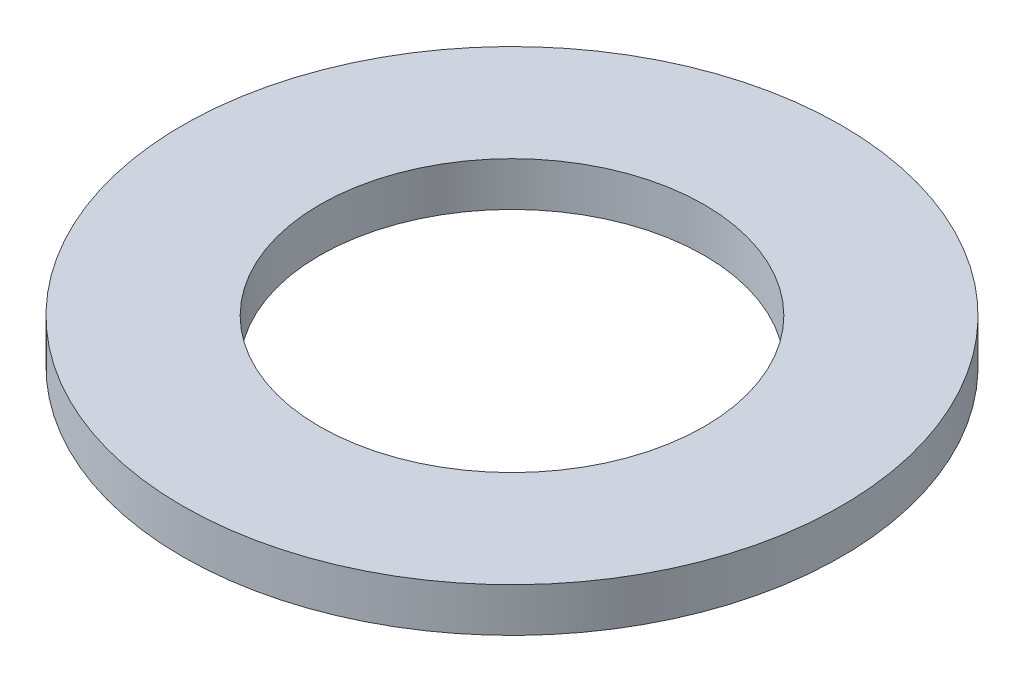
from build123d import *

# Parameters (mm, degrees)
SKETCH1_R           = 3
SKETCH1_R_2         = 1.75
BOSS_EXTRUDE1_DEPTH = 0.4


with BuildPart() as part:
    # Sketch1 → Boss-Extrude1 (new body)
    with BuildSketch(Plane(origin=(0, 0, 0), x_dir=(1, 0, 0), z_dir=(0, 1, 0))):
        with Locations(Location((0, 0, 0), (0, 0, 270))):
            Circle(SKETCH1_R)
        with Locations(Location((0, 0, 0), (0, 0, 270))):
            Circle(SKETCH1_R_2, mode=Mode.SUBTRACT)
    extrude(amount=BOSS_EXTRUDE1_DEPTH)


solid = part.part
